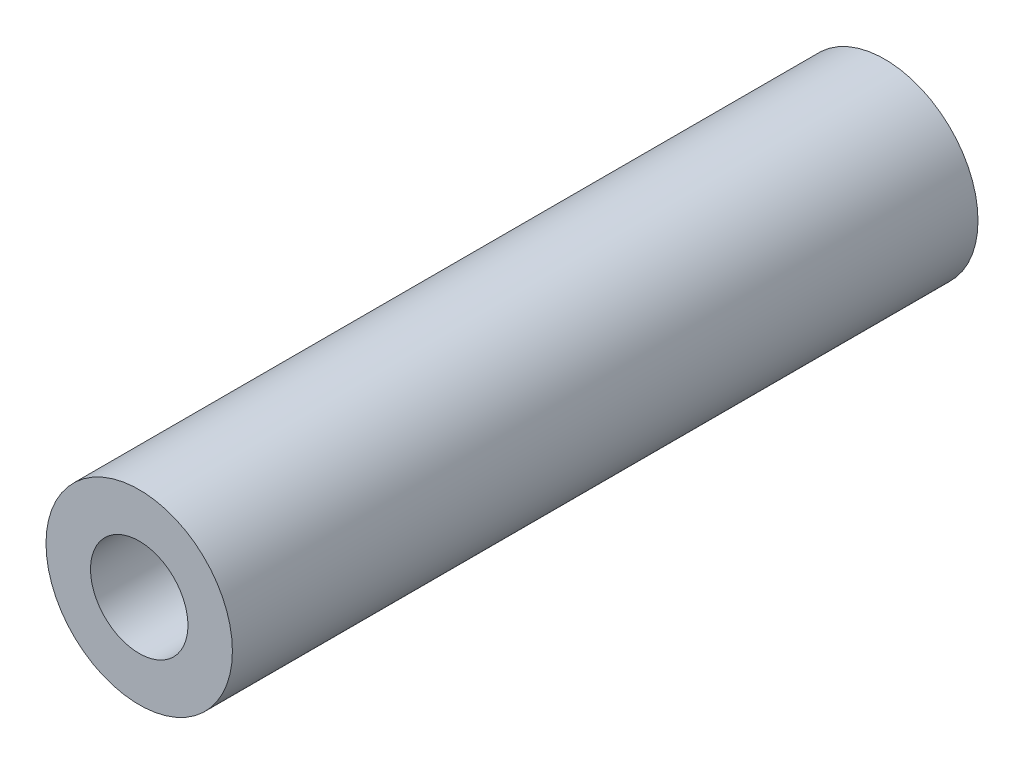
from build123d import *

# Parameters (mm, degrees)
SKETCH1_R           = 4.7625
SKETCH1_R_2         = 2.4892
BOSS_EXTRUDE1_DEPTH = 38.1


with BuildPart() as part:
    # Sketch1 → Boss-Extrude1 (new body)
    with BuildSketch(Plane.XY):
        with Locations(Location((0, 0, 0), (0, 0, 180))):
            Circle(SKETCH1_R)
        with Locations(Location((0, 0, 0), (0, 0, 180))):
            Circle(SKETCH1_R_2, mode=Mode.SUBTRACT)
    extrude(amount=BOSS_EXTRUDE1_DEPTH)


solid = part.part
